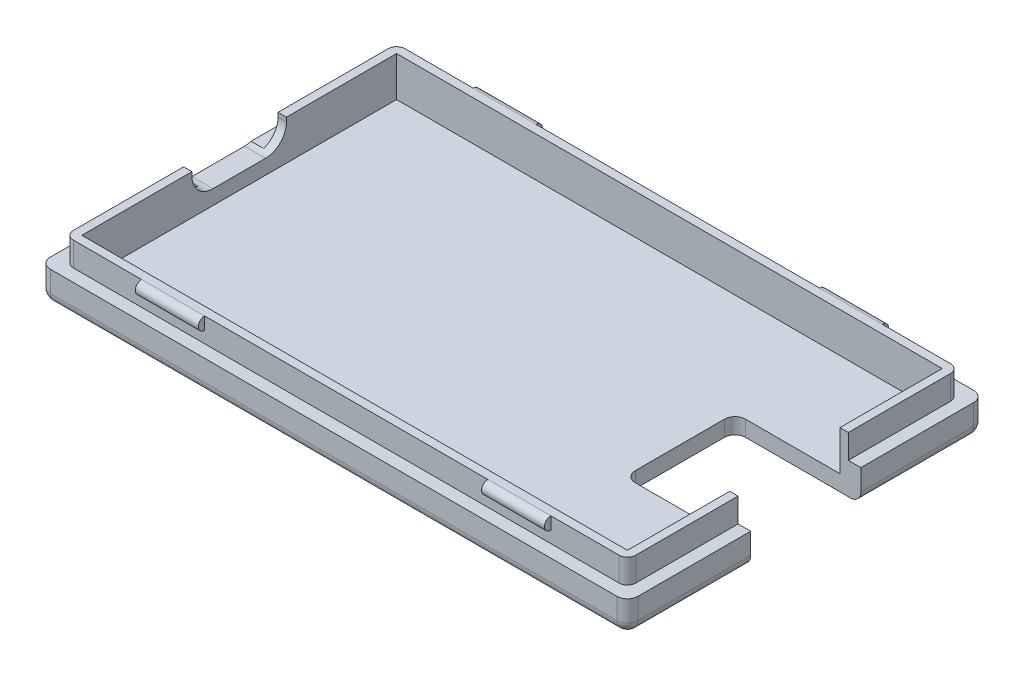
from build123d import *

# Parameters (mm, degrees)
SKETCH1_W           = 56
SKETCH1_H           = 34
BOSS_EXTRUDE1_DEPTH = 1.5
SKETCH1_3_W         = 56
SKETCH1_3_H         = 34
SKETCH1_3_W_2       = 52
SKETCH1_3_H_2       = 30
BOSS_EXTRUDE2_DEPTH = 3
SKETCH2_W           = 53.6
SKETCH2_H           = 31.6
SKETCH2_W_2         = 52
SKETCH2_H_2         = 30
BOSS_EXTRUDE3_DEPTH = 2.3
SKETCH3_W           = 1.2
SKETCH3_H           = 3.75
CUT_EXTRUDE1_DEPTH  = 1
BOSS_EXTRUDE4_START = 13.5
SKETCH4_R           = 0.6
BOSS_EXTRUDE4_DEPTH = 6
FILLET1_R           = 1
FILLET2_R           = 0.8
CUT_EXTRUDE2_DEPTH  = 34.182676203
CUT_EXTRUDE4_DEPTH  = 34.182676203


with BuildPart() as part:
    # Sketch1 → Boss-Extrude1 (new body)
    with BuildSketch(Plane(origin=(0, 0, 0), x_dir=(1, 0, 0), z_dir=(0, 1, 0))):
        Rectangle(SKETCH1_W, SKETCH1_H)
    extrude(amount=BOSS_EXTRUDE1_DEPTH)

    # Sketch1<3> → Boss-Extrude2 (add)
    with BuildSketch(Plane(origin=(0, 0, 0), x_dir=(1, 0, 0), z_dir=(0, 1, 0))):
        Rectangle(SKETCH1_3_W, SKETCH1_3_H)
        Rectangle(SKETCH1_3_W_2, SKETCH1_3_H_2, mode=Mode.SUBTRACT)
    extrude(amount=BOSS_EXTRUDE2_DEPTH)

    # Sketch2 → Boss-Extrude3 (add)
    with BuildSketch(Plane(origin=(0, 3, 0), x_dir=(1, 0, 0), z_dir=(0, 1, 0))):
        Rectangle(SKETCH2_W, SKETCH2_H)
        Rectangle(SKETCH2_W_2, SKETCH2_H_2, mode=Mode.SUBTRACT)
    extrude(amount=BOSS_EXTRUDE3_DEPTH)

    # Sketch3 → Cut-Extrude1 (cut)
    with BuildSketch(Plane(origin=(0, 3, 0), x_dir=(1, 0, 0), z_dir=(0, 1, 0))):
        with Locations((-27.4, -8.375)):
            Rectangle(SKETCH3_W, SKETCH3_H)
        with Locations((-27.4, 8.375)):
            Rectangle(SKETCH3_W, SKETCH3_H)
    extrude(amount=-CUT_EXTRUDE1_DEPTH, mode=Mode.SUBTRACT)

    # Sketch4 → Boss-Extrude4 (add)
    with BuildSketch(Plane(origin=(0, 0, 0), x_dir=(0, 0, -1), z_dir=(1, 0, 0)).offset(BOSS_EXTRUDE4_START)):
        with Locations((15.8, 4.7)):
            Circle(SKETCH4_R)
        with Locations((-15.8, 4.7)):
            Circle(SKETCH4_R)
    boss_extrude4 = extrude(amount=BOSS_EXTRUDE4_DEPTH)

    # Mirror1: Boss-Extrude4 across plane
    add(boss_extrude4.mirror(Plane(origin=(0, 0, 0), x_dir=(0, 0, 1), z_dir=(1, 0, 0))))

    # Fillet1
    fillet1_edges = [part.edges().sort_by_distance(p)[0] for p in [
        (0, 0, 17),
        (28, 0, 0),
        (0, 0, -17),
        (-28, 0, 0),
        (28, 1.5, 17),
        (-28, 1.5, 17),
        (-28, 1.5, -17),
        (28, 1.5, -17),
    ]]
    fillet(fillet1_edges, radius=FILLET1_R)

    # Fillet2
    fillet2_edges = [part.edges().sort_by_distance(p)[0] for p in [
        (26.8, 4.15, 15.8),
        (-26.8, 4.15, 15.8),
        (-26.8, 4.15, -15.8),
        (26.8, 4.15, -15.8),
    ]]
    fillet(fillet2_edges, radius=FILLET2_R)

    # Sketch5 → Cut-Extrude2 (cut, through all)
    with BuildSketch(Plane(origin=(0, 0, 0), x_dir=(0, 0, -1), z_dir=(1, 0, 0))):
        with BuildLine():
            Line((-4.5, 9.622902271), (4.5, 9.622902271))
            Line((4.5, 9.622902271), (4.5, 4.9))
            ThreePointArc((4.5, 4.9), (3.914213562, 3.485786438), (2.5, 2.9))
            Line((2.5, 2.9), (-2.5, 2.9))
            ThreePointArc((-2.5, 2.9), (-3.914213562, 3.485786438), (-4.5, 4.9))
            Line((-4.5, 4.9), (-4.5, 9.622902271))
        make_face()
    extrude(amount=-CUT_EXTRUDE2_DEPTH, mode=Mode.SUBTRACT)

    # Sketch7 → Cut-Extrude4 (cut, through all)
    with BuildSketch(Plane.XZ):
        with BuildLine():
            Line((32.037949749, -5.25), (17, -5.25))
            ThreePointArc((17, -5.25), (16.292893219, -4.957106781), (16, -4.25))
            Line((16, -4.25), (16, 4.25))
            ThreePointArc((16, 4.25), (16.292893219, 4.957106781), (17, 5.25))
            Line((17, 5.25), (32.037949749, 5.25))
            Line((32.037949749, 5.25), (32.037949749, -5.25))
        make_face()
    extrude(amount=-CUT_EXTRUDE4_DEPTH, mode=Mode.SUBTRACT)


solid = part.part
